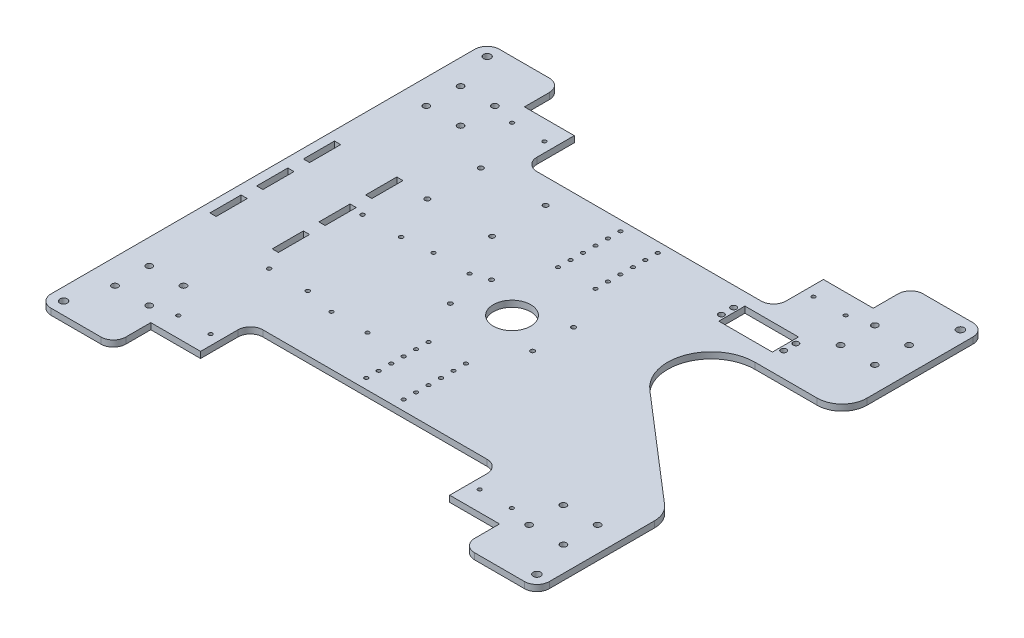
from build123d import *

# Parameters (mm, degrees)
SKETCH_4_R                = 15
EXTRUDE_1_DEPTH           = 5
SKETCH_6_R                = 1.5
SKETCH_6_R_2              = 2
SKETCH_6_R_3              = 1.6
SKETCH_6_R_4              = 1.75
CUT_EXTRUDE_2_DEPTH       = 5
SKETCH_7_R                = 1.5
CUT_EXTRUDE_3_DEPTH       = 270.118932816
SKETCH_8_R                = 3
CUT_EXTRUDE_4_DEPTH       = 10
SKETCH_10_W               = 5
SKETCH_10_H               = 25
CUT_EXTRUDE_6_DEPTH       = 10
SKETCH_13_R               = 2.5
CUT_EXTRUDE_8_DEPTH       = 10
SKETCH_17_R               = 1.5
CUT_EXTRUDE_11_DEPTH      = 10
FILLET_1_R                = 10
CUT_EXTRUDE_13_DEPTH      = 270.118932816
CUT_EXTRUDE_13_DEPTH_BACK = 270.118932816
FILLET_2_R                = 20
SKETCH_21_R               = 2.25
SKETCH_21_W               = 43
SKETCH_21_H               = 21
CUT_EXTRUDE_14_DEPTH      = 10


with BuildPart() as part:
    # 草圖4 → 伸長1 (new body)
    with BuildSketch(Plane(origin=(0, 0, 0), x_dir=(1, 0, 0), z_dir=(0, 1, 0))):
        Polygon((-200, 180), (-140, 180), (-140, 150), (-100, 150), (-100, 110), (100, 110), (100, 150), (140, 150), (140, 180), (200, 180), (200, -180), (140, -180), (140, -150), (100, -150), (100, -110), (-100, -110), (-100, -150), (-140, -150), (-140, -180), (-200, -180), align=None)
        with Locations(Location((0, 0, 0), (0, 0, 270))):
            Circle(SKETCH_4_R, mode=Mode.SUBTRACT)
    extrude(amount=EXTRUDE_1_DEPTH)

    # 草圖6 → 伸長2 (cut)
    with BuildSketch(Plane(origin=(0, 5, 0), x_dir=(-1, 0, 0), z_dir=(0, 1, 0))):
        with Locations(Location((75, -12, 0), (0, 0, 90))):
            Circle(SKETCH_6_R)
        with Locations(Location((46, -12, 0), (0, 0, 90))):
            Circle(SKETCH_6_R)
        with Locations(Location((46, 70, 0), (0, 0, 90))):
            Circle(SKETCH_6_R)
        with Locations(Location((75, 70, 0), (0, 0, 90))):
            Circle(SKETCH_6_R)
        with Locations(Location((63, -90, 0), (0, 0, 90))):
            Circle(SKETCH_6_R_2)
        with Locations(Location((115, -90, 0), (0, 0, 90))):
            Circle(SKETCH_6_R_2)
        with Locations(Location((115, -47, 0), (0, 0, 90))):
            Circle(SKETCH_6_R_2)
        with Locations(Location((63, -47, 0), (0, 0, 90))):
            Circle(SKETCH_6_R_2)
        with Locations(Location((130, -10, 0), (0, 0, 90))):
            Circle(SKETCH_6_R_3)
        with Locations(Location((130, 65, 0), (0, 0, 90))):
            Circle(SKETCH_6_R_3)
        with Locations(Location((99, 65, 0), (0, 0, 90))):
            Circle(SKETCH_6_R_3)
        with Locations(Location((99, -10, 0), (0, 0, 90))):
            Circle(SKETCH_6_R_3)
        with Locations(Location((33, 16.5, 0), (0, 0, 90))):
            Circle(SKETCH_6_R_4)
        with Locations(Location((33, -16.5, 0), (0, 0, 90))):
            Circle(SKETCH_6_R_4)
        with Locations(Location((-33, -16.5, 0), (0, 0, 90))):
            Circle(SKETCH_6_R_4)
        with Locations(Location((-33, 16.5, 0), (0, 0, 90))):
            Circle(SKETCH_6_R_4)
    extrude(amount=-CUT_EXTRUDE_2_DEPTH, mode=Mode.SUBTRACT)

    # 草圖7 → 伸長3 (cut, through all)
    with BuildSketch(Plane(origin=(0, 5, 0), x_dir=(1, 0, 0), z_dir=(0, 1, 0))):
        with Locations(Location((-15, -102, 0), (0, 0, 270))):
            Circle(SKETCH_7_R)
        with Locations(Location((-15, -92, 0), (0, 0, 270))):
            Circle(SKETCH_7_R)
        with Locations(Location((-15, -82, 0), (0, 0, 270))):
            Circle(SKETCH_7_R)
        with Locations(Location((-15, -72, 0), (0, 0, 270))):
            Circle(SKETCH_7_R)
        with Locations(Location((-15, -62, 0), (0, 0, 270))):
            Circle(SKETCH_7_R)
        with Locations(Location((-15, -52, 0), (0, 0, 270))):
            Circle(SKETCH_7_R)
        with Locations(Location((15, -102, 0), (0, 0, 270))):
            Circle(SKETCH_7_R)
        with Locations(Location((15, -92, 0), (0, 0, 270))):
            Circle(SKETCH_7_R)
        with Locations(Location((15, -72, 0), (0, 0, 270))):
            Circle(SKETCH_7_R)
        with Locations(Location((15, -62, 0), (0, 0, 270))):
            Circle(SKETCH_7_R)
        with Locations(Location((15, -52, 0), (0, 0, 270))):
            Circle(SKETCH_7_R)
        with Locations(Location((15, -82, 0), (0, 0, 270))):
            Circle(SKETCH_7_R)
        with Locations(Location((-15, 52, 0), (0, 0, 270))):
            Circle(SKETCH_7_R)
        with Locations(Location((-15, 62, 0), (0, 0, 270))):
            Circle(SKETCH_7_R)
        with Locations(Location((-15, 72, 0), (0, 0, 270))):
            Circle(SKETCH_7_R)
        with Locations(Location((-15, 82, 0), (0, 0, 270))):
            Circle(SKETCH_7_R)
        with Locations(Location((-15, 92, 0), (0, 0, 270))):
            Circle(SKETCH_7_R)
        with Locations(Location((-15, 102, 0), (0, 0, 270))):
            Circle(SKETCH_7_R)
        with Locations(Location((15, 52, 0), (0, 0, 270))):
            Circle(SKETCH_7_R)
        with Locations(Location((15, 62, 0), (0, 0, 270))):
            Circle(SKETCH_7_R)
        with Locations(Location((15, 82, 0), (0, 0, 270))):
            Circle(SKETCH_7_R)
        with Locations(Location((15, 92, 0), (0, 0, 270))):
            Circle(SKETCH_7_R)
        with Locations(Location((15, 102, 0), (0, 0, 270))):
            Circle(SKETCH_7_R)
        with Locations(Location((15, 72, 0), (0, 0, 270))):
            Circle(SKETCH_7_R)
    extrude(amount=-CUT_EXTRUDE_3_DEPTH, mode=Mode.SUBTRACT)

    # 草圖8 → 伸長4 (cut)
    with BuildSketch(Plane(origin=(0, 5, 0), x_dir=(1, 0, 0), z_dir=(0, 1, 0))):
        with Locations(Location((190, 170, 0), (0, 0, 270))):
            Circle(SKETCH_8_R)
        with Locations(Location((-190, 170, 0), (0, 0, 270))):
            Circle(SKETCH_8_R)
        with Locations(Location((-190, -170, 0), (0, 0, 270))):
            Circle(SKETCH_8_R)
        with Locations(Location((190, -170, 0), (0, 0, 270))):
            Circle(SKETCH_8_R)
    extrude(amount=-CUT_EXTRUDE_4_DEPTH, mode=Mode.SUBTRACT)

    # 草圖10 → 伸長6 (cut)
    with BuildSketch(Plane(origin=(0, 5, 0), x_dir=(1, 0, 0), z_dir=(0, 1, 0))):
        with Locations((-140, -37.5)):
            Rectangle(SKETCH_10_W, SKETCH_10_H)
        with Locations((-190, -37.5)):
            Rectangle(SKETCH_10_W, SKETCH_10_H)
        with Locations((-140, 37.5)):
            Rectangle(SKETCH_10_W, SKETCH_10_H)
        with Locations((-190, 37.5)):
            Rectangle(SKETCH_10_W, SKETCH_10_H)
        with Locations((-190, 0)):
            Rectangle(SKETCH_10_W, SKETCH_10_H)
        with Locations((-140, 0)):
            Rectangle(SKETCH_10_W, SKETCH_10_H)
    extrude(amount=-CUT_EXTRUDE_6_DEPTH, mode=Mode.SUBTRACT)

    # 草圖13 → 伸長8 (cut)
    with BuildSketch(Plane(origin=(0, 5, 0), x_dir=(-1, 0, 0), z_dir=(0, 1, 0))):
        with Locations(Location((180, -138.75, 0), (0, 0, 90))):
            Circle(SKETCH_13_R)
        with Locations(Location((152.5, -138.75, 0), (0, 0, 90))):
            Circle(SKETCH_13_R)
        with Locations(Location((152.5, -111.25, 0), (0, 0, 90))):
            Circle(SKETCH_13_R)
        with Locations(Location((180, -111.25, 0), (0, 0, 90))):
            Circle(SKETCH_13_R)
        with Locations(Location((-152.5, -138.75, 0), (0, 0, 90))):
            Circle(SKETCH_13_R)
        with Locations(Location((-180, -138.75, 0), (0, 0, 90))):
            Circle(SKETCH_13_R)
        with Locations(Location((-180, -111.25, 0), (0, 0, 90))):
            Circle(SKETCH_13_R)
        with Locations(Location((-152.5, -111.25, 0), (0, 0, 90))):
            Circle(SKETCH_13_R)
        with Locations(Location((180, 111.25, 0), (0, 0, 90))):
            Circle(SKETCH_13_R)
        with Locations(Location((152.5, 111.25, 0), (0, 0, 90))):
            Circle(SKETCH_13_R)
        with Locations(Location((152.5, 138.75, 0), (0, 0, 90))):
            Circle(SKETCH_13_R)
        with Locations(Location((180, 138.75, 0), (0, 0, 90))):
            Circle(SKETCH_13_R)
        with Locations(Location((-152.5, 111.25, 0), (0, 0, 90))):
            Circle(SKETCH_13_R)
        with Locations(Location((-180, 111.25, 0), (0, 0, 90))):
            Circle(SKETCH_13_R)
        with Locations(Location((-180, 138.75, 0), (0, 0, 90))):
            Circle(SKETCH_13_R)
        with Locations(Location((-152.5, 138.75, 0), (0, 0, 90))):
            Circle(SKETCH_13_R)
    extrude(amount=-CUT_EXTRUDE_8_DEPTH, mode=Mode.SUBTRACT)

    # 草圖17 → 伸長11 (cut)
    with BuildSketch(Plane(origin=(0, 5, 0), x_dir=(-1, 0, 0), z_dir=(0, 1, 0))):
        with Locations(Location((-108, -134, 0), (0, 0, 90))):
            Circle(SKETCH_17_R)
        with Locations(Location((-133.89, -134, 0), (0, 0, 90))):
            Circle(SKETCH_17_R)
        with Locations(Location((-108, 134, 0), (0, 0, 90))):
            Circle(SKETCH_17_R)
        with Locations(Location((-133.89, 134, 0), (0, 0, 90))):
            Circle(SKETCH_17_R)
        with Locations(Location((133.89, -134, 0), (0, 0, 90))):
            Circle(SKETCH_17_R)
        with Locations(Location((108, -134, 0), (0, 0, 90))):
            Circle(SKETCH_17_R)
        with Locations(Location((133.89, 134, 0), (0, 0, 90))):
            Circle(SKETCH_17_R)
        with Locations(Location((108, 134, 0), (0, 0, 90))):
            Circle(SKETCH_17_R)
    extrude(amount=-CUT_EXTRUDE_11_DEPTH, mode=Mode.SUBTRACT)

    # 圓角1
    fillet_1_edges = [part.edges().sort_by_distance(p)[0] for p in [
        (-200, 2.5, -180),
        (-140, 2.5, -180),
        (-100, 2.5, -110),
        (100, 2.5, -110),
        (140, 2.5, -180),
        (200, 2.5, -180),
        (200, 2.5, 180),
        (140, 2.5, 180),
        (100, 2.5, 110),
        (-100, 2.5, 110),
        (-140, 2.5, 180),
        (-200, 2.5, 180),
    ]]
    fillet(fillet_1_edges, radius=FILLET_1_R)

    # 草圖19 → 伸長13 (cut, two sides: drawn at the far end of the back side and taken through both)
    with BuildSketch(Plane(origin=(0, 5, 0), x_dir=(1, 0, 0), z_dir=(0, 1, 0)).offset(-CUT_EXTRUDE_13_DEPTH_BACK)):
        with BuildLine():
            Line((200, 65), (130, 65))
            ThreePointArc((130, 65), (97.189752759, 42.185551936), (107.153658755, 3.485010057))
            Line((107.153658755, 3.485010057), (200, -76.514989943))
            Line((200, -76.514989943), (200, 65))
        make_face()
    extrude(amount=CUT_EXTRUDE_13_DEPTH + CUT_EXTRUDE_13_DEPTH_BACK, mode=Mode.SUBTRACT)

    # 圓角2
    fillet_2_edges = [part.edges().sort_by_distance(p)[0] for p in [
        (200, 2.5, 76.514989943),
        (200, 2.5, -65),
    ]]
    fillet(fillet_2_edges, radius=FILLET_2_R)

    # 草圖21 → 伸長14 (cut)
    with BuildSketch(Plane(origin=(0, 5, 0), x_dir=(1, 0, 0), z_dir=(0, 1, 0))):
        with Locations(Location((83.5, 94.4, 0), (0, 0, 270))):
            Circle(SKETCH_21_R)
        with Locations(Location((83.5, 84.6, 0), (0, 0, 270))):
            Circle(SKETCH_21_R)
        with Locations(Location((133.5, 84.6, 0), (0, 0, 270))):
            Circle(SKETCH_21_R)
        with Locations(Location((133.5, 94.4, 0), (0, 0, 270))):
            Circle(SKETCH_21_R)
        with Locations((108.5, 89.5)):
            Rectangle(SKETCH_21_W, SKETCH_21_H)
    extrude(amount=-CUT_EXTRUDE_14_DEPTH, mode=Mode.SUBTRACT)


solid = part.part
